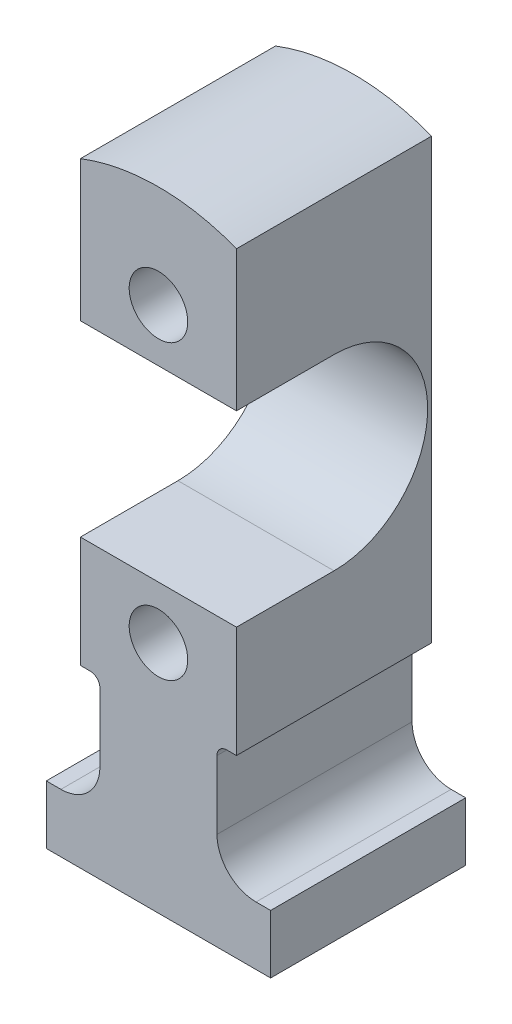
from build123d import *

# Parameters (mm, degrees)
BOSS_EXTRUDE1_DEPTH     = 100
FILLET1_R               = 5
FILLET2_R               = 5
FILLET3_R               = 20
FILLET4_R               = 20
SKETCH5_R               = 15
CUT_EXTRUDE1_DEPTH      = 208.498638182
SKETCH16_R              = 15
CUT_EXTRUDE5_DEPTH      = 208.498638182
CUT_EXTRUDE8_DEPTH      = 208.498638182
CUT_EXTRUDE8_DEPTH_BACK = 208.498638182


with BuildPart() as part:
    # Sketch4 → Boss-Extrude1 (new body)
    with BuildSketch(Plane.XY):
        with BuildLine():
            Line((-40, -60), (-30, -60))
            Line((-30, -60), (0, -60))
            Line((0, -60), (30, -60))
            Line((30, -60), (40, -60))
            Line((40, -60), (40, 164.983908243))
            ThreePointArc((40, 164.983908243), (39.979276225, 164.991956207), (39.958550831, 165))
            ThreePointArc((39.958550831, 165), (0, 172.480244803), (-39.958550831, 165))
            ThreePointArc((-39.958550831, 165), (-39.979276225, 164.991956207), (-40, 164.983908243))
            Line((-40, 164.983908243), (-40, -60))
        make_face()
        Polygon((-30, -60), (-30, -105), (0, -105), (30, -105), (30, -60), (0, -60), align=None)
        Polygon((57.5, -120), (-57.5, -120), (-57.5, -150), (0, -150), (57.5, -150), align=None)
        Polygon((0, -105), (-30, -105), (-30, -120), (30, -120), (30, -105), align=None)
    extrude(amount=BOSS_EXTRUDE1_DEPTH)

    # Fillet1
    fillet1_edges = [part.edges().sort_by_distance(p)[0] for p in [
        (-30, -60, 50),
    ]]
    fillet(fillet1_edges, radius=FILLET1_R)

    # Fillet2
    fillet2_edges = [part.edges().sort_by_distance(p)[0] for p in [
        (30, -60, 50),
    ]]
    fillet(fillet2_edges, radius=FILLET2_R)

    # Fillet3
    fillet3_edges = [part.edges().sort_by_distance(p)[0] for p in [
        (-30, -120, 50),
    ]]
    fillet(fillet3_edges, radius=FILLET3_R)

    # Fillet4
    fillet4_edges = [part.edges().sort_by_distance(p)[0] for p in [
        (30, -120, 50),
    ]]
    fillet(fillet4_edges, radius=FILLET4_R)

    # Sketch5 → Cut-Extrude1 (cut, through all)
    with BuildSketch(Plane.XY.offset(100)):
        with Locations((0, 120)):
            Circle(SKETCH5_R)
    extrude(amount=-CUT_EXTRUDE1_DEPTH, mode=Mode.SUBTRACT)

    # Sketch16 → Cut-Extrude5 (cut, through all)
    with BuildSketch(Plane.XY.offset(100)):
        with Locations((0, -30)):
            Circle(SKETCH16_R)
    extrude(amount=-CUT_EXTRUDE5_DEPTH, mode=Mode.SUBTRACT)

    # Sketch19 → Cut-Extrude8 (cut, two sides: drawn at the far end of the back side and taken through both)
    with BuildSketch(Plane(origin=(0, 0, 0), x_dir=(0, 0, -1), z_dir=(1, 0, 0)).offset(-CUT_EXTRUDE8_DEPTH_BACK)):
        with BuildLine():
            Line((-50, 93), (-100, 93))
            Line((-100, 93), (-100, -3))
            Line((-100, -3), (-50, -3))
            ThreePointArc((-50, -3), (-2, 45), (-50, 93))
        make_face()
    extrude(amount=CUT_EXTRUDE8_DEPTH + CUT_EXTRUDE8_DEPTH_BACK, mode=Mode.SUBTRACT)


solid = part.part
